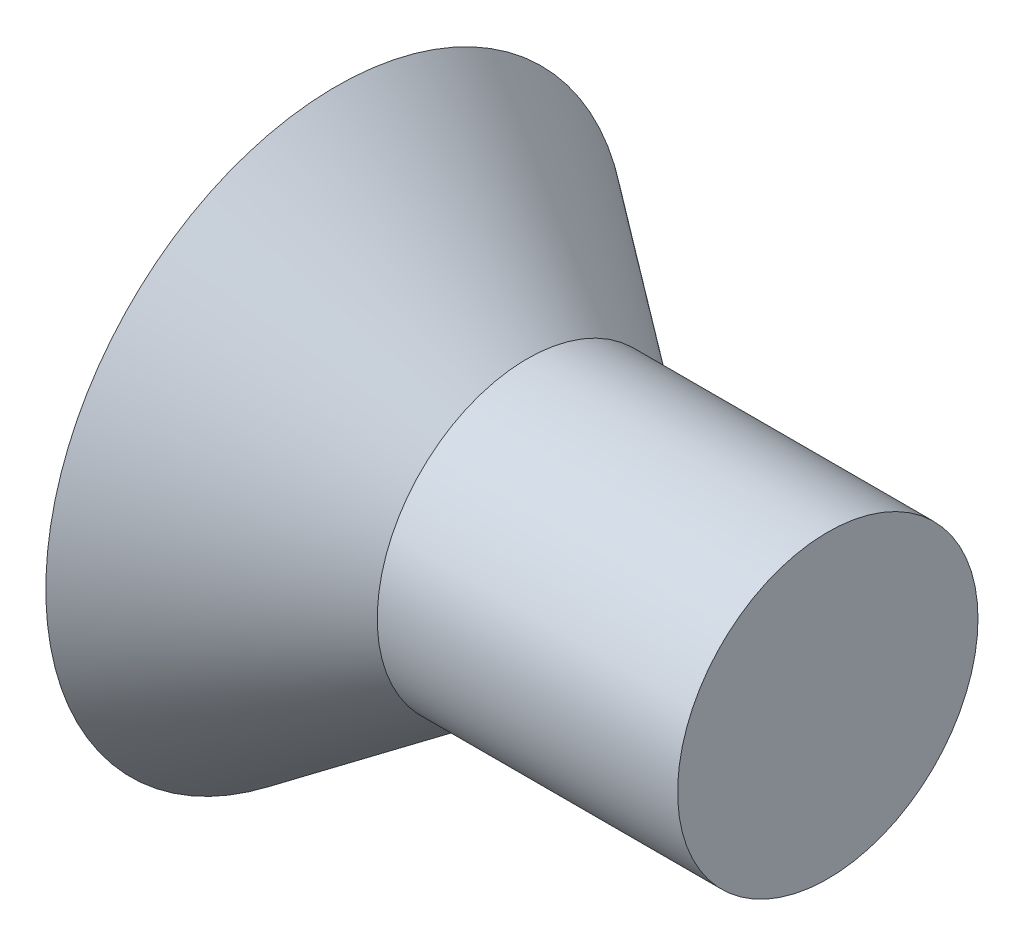
from build123d import *

# Parameters (mm, degrees)
CUT_EXTRUDE1_DEPTH = 1


with BuildPart() as part:
    # Sketch1 → Revolve2 (revolve)
    with BuildSketch(Plane.XY, mode=Mode.PRIVATE) as revolve2_sk:
        Polygon((4.91, 0), (4.91, 1.5), (1.91, 1.5), (0, 2.9), (0, 0), align=None)
    revolve(revolve2_sk.sketch.rotate(Axis((4.91, 0, 0), (-1, 0, 0)), 90), axis=Axis((4.91, 0, 0), (-1, 0, 0)))

    # Sketch2 → Cut-Extrude1 (cut)
    with BuildSketch(Plane.ZY):
        Polygon((1.154700538, 0), (0.577350269, 1), (-0.577350269, 1), (-1.154700538, 0), (-0.577350269, -1), (0.577350269, -1), align=None)
    extrude(amount=-CUT_EXTRUDE1_DEPTH, mode=Mode.SUBTRACT)


solid = part.part
